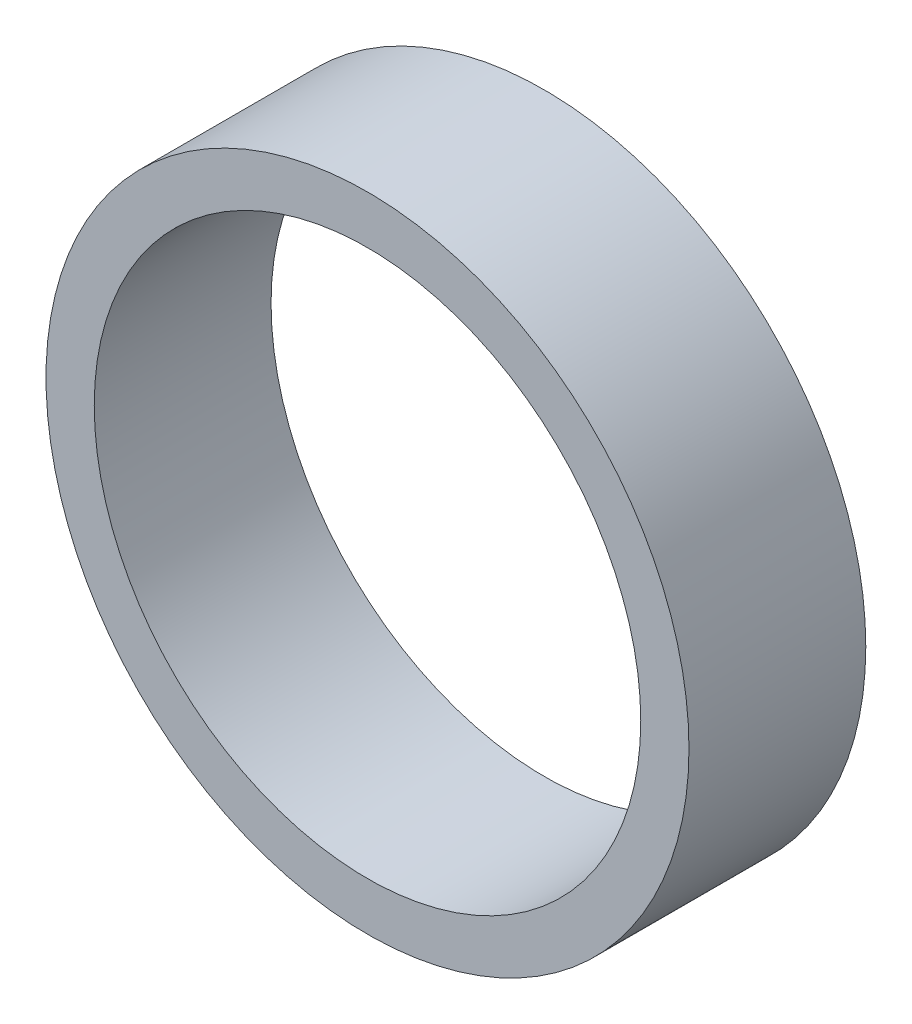
from build123d import *

# Parameters (mm, degrees)
SKETCH_1_R      = 40
SKETCH_1_R_2    = 34
EXTRUDE_1_DEPTH = 22


with BuildPart() as part:
    # 草图1 → 凸台-拉伸1 (new body)
    with BuildSketch(Plane.XY):
        Circle(SKETCH_1_R)
        Circle(SKETCH_1_R_2, mode=Mode.SUBTRACT)
    extrude(amount=EXTRUDE_1_DEPTH)


solid = part.part
